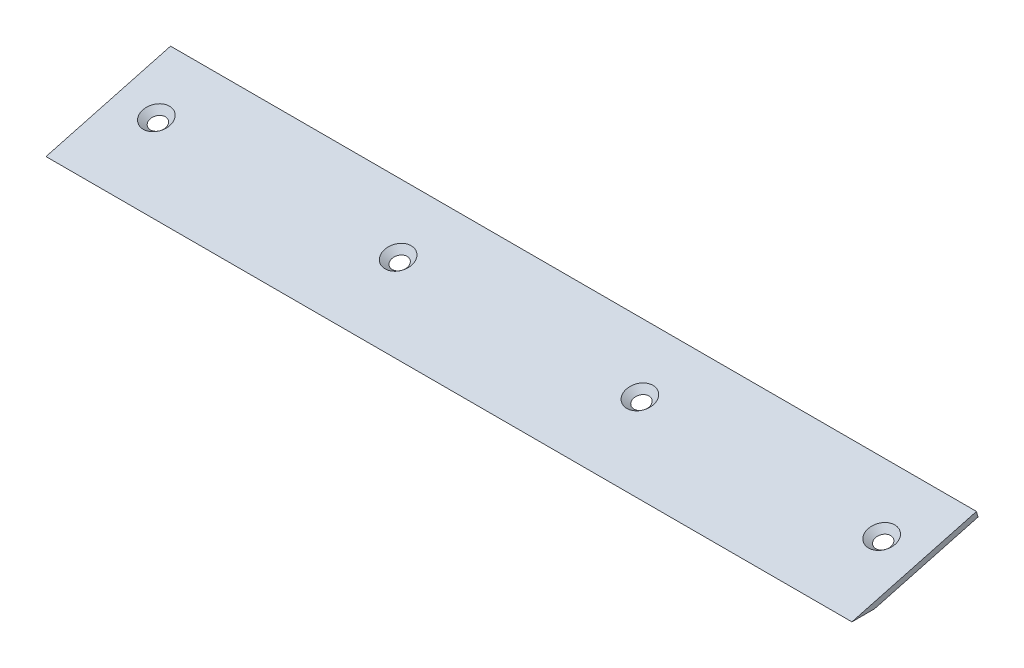
from build123d import *

# Parameters (mm, degrees)
SALIENTE_EXTRUIR1_DEPTH                              = 200
REFRENTADO_PARA_TORNILLO_TAP_N_CON_CABEZ_D           = 3.4
REFRENTADO_PARA_TORNILLO_TAP_N_CON_CABEZ_CSINK_D     = 6.72
REFRENTADO_PARA_TORNILLO_TAP_N_CON_CABEZ_CSINK_ANGLE = 90


with BuildPart() as part:
    # Croquis1 → Saliente-Extruir1 (new body)
    with BuildSketch(Plane(origin=(0, 0, 0), x_dir=(0, 0, -1), z_dir=(1, 0, 0))):
        Polygon((0, 0), (30.909626441, 8.282209443), (31.284914057, 6.881616995), (5.602369792, 0), align=None)
    extrude(amount=-SALIENTE_EXTRUIR1_DEPTH)

    # Refrentado para tornillo tapón con cabeza plana de clavija de M31 (through all)
    with Locations(Plane(origin=(0, 0, 0), x_dir=(1, 0, 0), z_dir=(0, 0.9659258262890681, 0.2588190451025215))):
        with Locations((-190, 18), (-130, 18), (-70, 18), (-10, 18)):
            CounterSinkHole(REFRENTADO_PARA_TORNILLO_TAP_N_CON_CABEZ_D / 2, REFRENTADO_PARA_TORNILLO_TAP_N_CON_CABEZ_CSINK_D / 2, counter_sink_angle=REFRENTADO_PARA_TORNILLO_TAP_N_CON_CABEZ_CSINK_ANGLE)


solid = part.part
